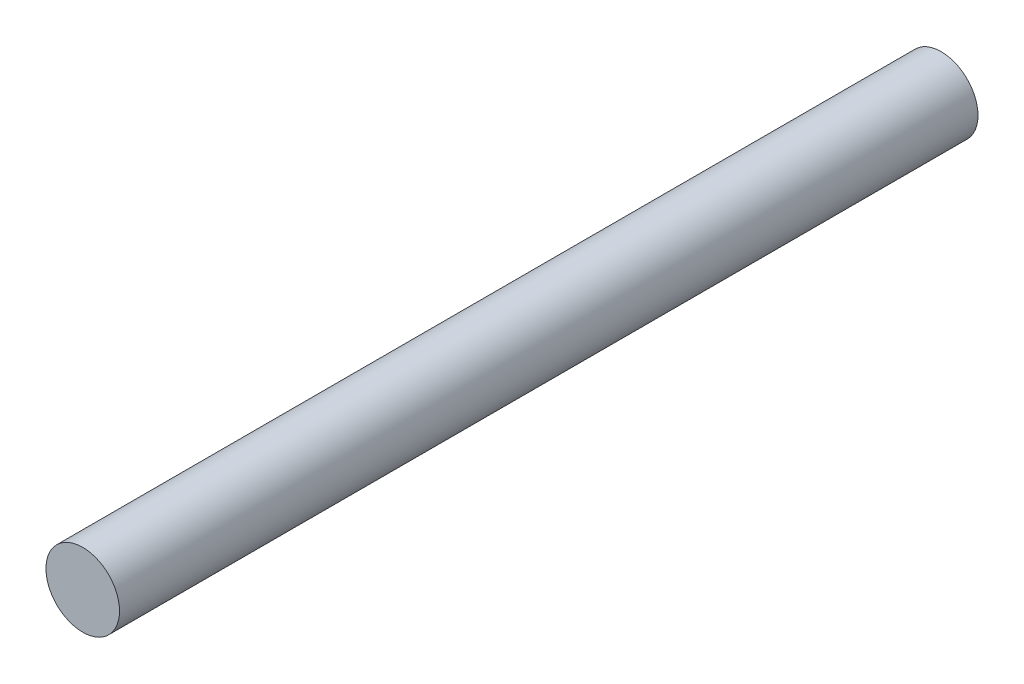
from build123d import *

# Parameters (mm, degrees)
SKETCH1_R           = 30
BOSS_EXTRUDE1_DEPTH = 700


with BuildPart() as part:
    # Sketch1 → Boss-Extrude1 (new body)
    with BuildSketch(Plane.XY):
        Circle(SKETCH1_R)
    extrude(amount=BOSS_EXTRUDE1_DEPTH)


solid = part.part
